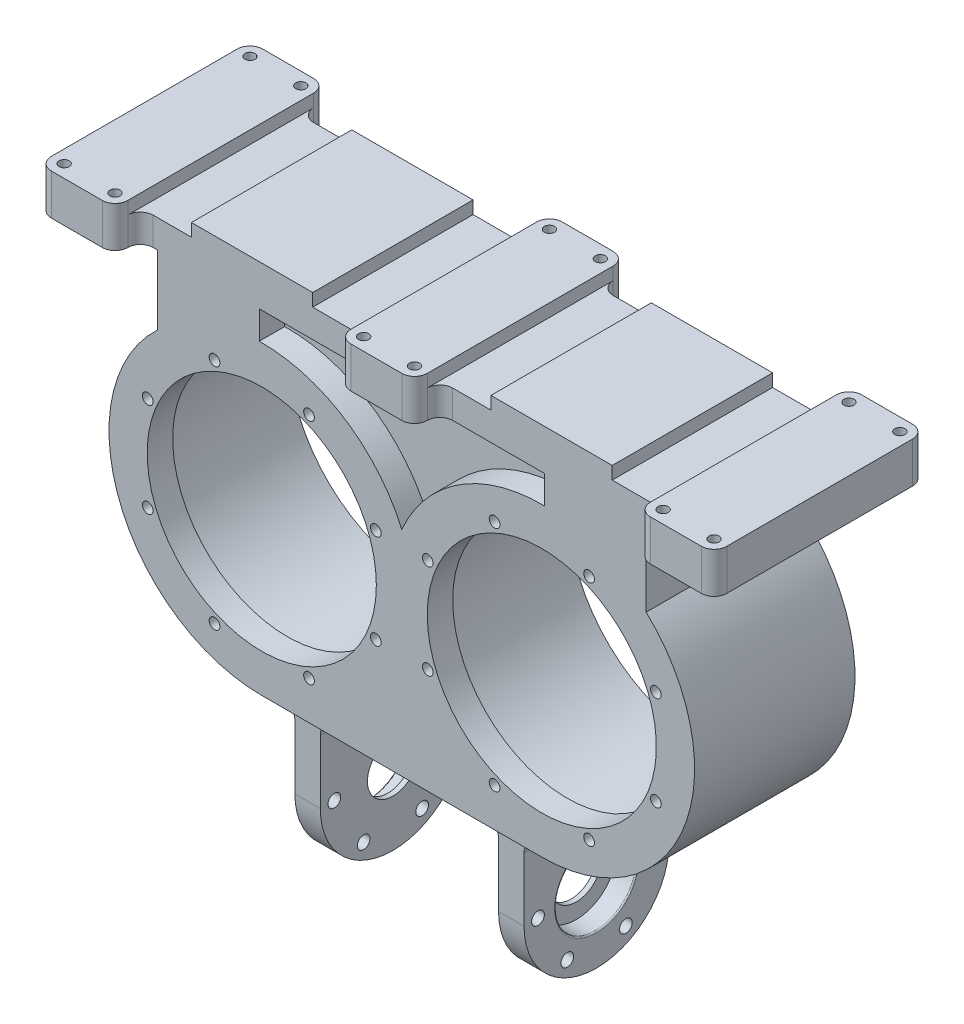
from build123d import *

# Parameters (mm, degrees)
SKETCH_1_R          = 52.5
EXTRUDE_1_DEPTH     = 63
SKETCH_3_R          = 10
EXTRUDE_3_DEPTH     = 10
EXTRUDE_5_DEPTH     = 57
EXTRUDE_START       = -10
SKETCH_6_R          = 52.5
SKETCH_6_R_2        = 45
EXTRUDE_6_DEPTH     = 10
SKETCH_9_R          = 2.1
CUT_EXTRUDE_1_DEPTH = 10
CUT_EXTRUDE_START   = -10
CUT_EXTRUDE_2_DEPTH = 10
SKETCH_11_R         = 16
CUT_EXTRUDE_3_DEPTH = 8
FILLET_1_R          = 0.5
EXTRUDE_7_DEPTH     = 11.027752017
SKETCH_14_R         = 2.5
CUT_EXTRUDE_5_DEPTH = 135
EXTRUDE_START_2     = 5
SKETCH_16_W         = 47.641975029
SKETCH_16_H         = 63
EXTRUDE_8_DEPTH     = 5
SKETCH_15_R         = 2
CUT_EXTRUDE_7_DEPTH = 14


with BuildPart() as part:
    # 草图1 → 凸台-拉伸1 (new body)
    with BuildSketch(Plane.XY):
        with BuildLine():
            Line((-40.985160522, 43.820276322), (-40.985160522, 71.041954073))
            Line((-40.985160522, 71.041954073), (-77.641975029, 71.041954073))
            Line((-77.641975029, 71.041954073), (-77.641975029, 82.069706091))
            Line((-77.641975029, 82.069706091), (-40.985160522, 82.069706091))
            Line((-40.985160522, 82.069706091), (150.985160522, 82.069706091))
            Line((150.985160522, 82.069706091), (187.641975029, 82.069706091))
            Line((187.641975029, 82.069706091), (187.641975029, 71.041954073))
            Line((187.641975029, 71.041954073), (150.985160522, 71.041954073))
            Line((150.985160522, 71.041954073), (150.985160522, 43.820276322))
            ThreePointArc((150.985160522, 43.820276322), (165.808675756, -22.031607076), (110, -60))
            Line((110, -60), (0, -60))
            ThreePointArc((0, -60), (-55.808675756, -22.031607076), (-40.985160522, 43.820276322))
        make_face()
        Circle(SKETCH_1_R, mode=Mode.SUBTRACT)
        with Locations(Location((110, 0, 0), (0, 0, 180))):
            Circle(SKETCH_1_R, mode=Mode.SUBTRACT)
    extrude(amount=EXTRUDE_1_DEPTH)

    # 草图3 → 凸台-拉伸3 (add)
    with BuildSketch(Plane(origin=(10, 0, 0), x_dir=(0, 0, -1), z_dir=(1, 0, 0))):
        with BuildLine():
            Line((-60, -60), (-60, -90))
            ThreePointArc((-60, -90), (-31.5, -118.5), (-3, -90))
            Line((-3, -90), (-3, -60))
            Line((-3, -60), (-60, -60))
        make_face()
        with Locations((-31.5, -90)):
            Circle(SKETCH_3_R, mode=Mode.SUBTRACT)
    extrude_3 = extrude(amount=EXTRUDE_3_DEPTH)

    # 草图5 → 凸台-拉伸5 (add)
    with BuildSketch(Plane(origin=(0, 0, 3), x_dir=(-1, 0, 0), z_dir=(0, 0, -1))):
        with BuildLine():
            Line((-20, -65), (-20, -60))
            Line((-20, -60), (-25, -60))
            ThreePointArc((-25, -60), (-21.464466094, -61.464466094), (-20, -65))
        make_face()
        with BuildLine():
            Line((-10, -65), (-10, -60))
            Line((-10, -60), (-5, -60))
            ThreePointArc((-5, -60), (-8.535533906, -61.464466094), (-10, -65))
        make_face()
    extrude_5 = extrude(amount=-EXTRUDE_5_DEPTH)

    # 镜向1: 凸台-拉伸3, 凸台-拉伸5 across plane
    add(extrude_3.mirror(Plane(origin=(55, 0, 0), x_dir=(0, 0, 1), z_dir=(1, 0, 0))))
    add(extrude_5.mirror(Plane(origin=(55, 0, 0), x_dir=(0, 0, 1), z_dir=(1, 0, 0))))

    # 草图6 → 凸台-拉伸6 (add)
    # profile 1 of 2: a face of its own
    with BuildSketch(Plane.XY.offset(63).offset(EXTRUDE_START)):
        Circle(SKETCH_6_R)
        Circle(SKETCH_6_R_2, mode=Mode.SUBTRACT)
    # profile 2 of 2: a face of its own
    with BuildSketch(Plane.XY.offset(63).offset(EXTRUDE_START)):
        with Locations(Location((110, 0, 0), (0, 0, 180))):
            Circle(SKETCH_6_R)
        with Locations(Location((110, 0, 0), (0, 0, 180))):
            Circle(SKETCH_6_R_2, mode=Mode.SUBTRACT)
    extrude(amount=EXTRUDE_6_DEPTH)

    # 草图9 → 切除-拉伸1 (cut)
    with BuildSketch(Plane.XY.offset(63)):
        with Locations((65.191842673, 18.56014647)):
            Circle(SKETCH_9_R)
        with Locations((91.43985353, 44.808157327)):
            Circle(SKETCH_9_R)
        with Locations((128.56014647, 44.808157327)):
            Circle(SKETCH_9_R)
        with Locations((154.808157327, 18.56014647)):
            Circle(SKETCH_9_R)
        with Locations((154.808157327, -18.56014647)):
            Circle(SKETCH_9_R)
        with Locations((128.56014647, -44.808157327)):
            Circle(SKETCH_9_R)
        with Locations((91.43985353, -44.808157327)):
            Circle(SKETCH_9_R)
        with Locations((65.191842673, -18.56014647)):
            Circle(SKETCH_9_R)
    cut_extrude_1 = extrude(amount=-CUT_EXTRUDE_1_DEPTH, mode=Mode.SUBTRACT)

    # 镜向2: 切除-拉伸1 across plane
    add(cut_extrude_1.mirror(Plane(origin=(55, 0, 0), x_dir=(0, 0, 1), z_dir=(1, 0, 0))), mode=Mode.SUBTRACT)

    # 草图10 → 切除-拉伸2 (cut)
    with BuildSketch(Plane.XY.offset(63).offset(CUT_EXTRUDE_START)):
        with BuildLine():
            Line((110.985160522, 59.991911611), (110.985160522, 71.041954073))
            Line((110.985160522, 71.041954073), (-0.985160522, 71.041954073))
            Line((-0.985160522, 71.041954073), (-0.985160522, 59.991911611))
            ThreePointArc((-0.985160522, 59.991911611), (32.459672419, 50.461566231), (55, 23.979157617))
            ThreePointArc((55, 23.979157617), (77.540327581, 50.461566231), (110.985160522, 59.991911611))
        make_face()
    cut_extrude_2 = extrude(amount=CUT_EXTRUDE_2_DEPTH, mode=Mode.SUBTRACT)

    # 草图11 → 切除-拉伸3 (cut)
    with BuildSketch(Plane.ZY.offset(-10)):
        with Locations((31.5, -90)):
            Circle(SKETCH_11_R)
    cut_extrude_3 = extrude(amount=-CUT_EXTRUDE_3_DEPTH, mode=Mode.SUBTRACT)

    # 镜向3: 切除-拉伸2 across plane
    add(cut_extrude_2.mirror(Plane.XY.offset(31.5)), mode=Mode.SUBTRACT)

    # 镜向4: 切除-拉伸3 across plane
    add(cut_extrude_3.mirror(Plane(origin=(55, 0, 0), x_dir=(0, 0, 1), z_dir=(1, 0, 0))), mode=Mode.SUBTRACT)

    # 圆角1
    fillet_1_edges = [part.edges().sort_by_distance(p)[0] for p in [
        (10, -90, 15.5),
        (100, -90, 15.5),
    ]]
    fillet(fillet_1_edges, radius=FILLET_1_R)

    # 草图13 → 凸台-拉伸7 (add)
    with BuildSketch(Plane(origin=(0, 82.069706091, 0), x_dir=(1, 0, 0), z_dir=(0, 1, 0))):
        with BuildLine():
            Line((152.641975029, -63), (187.641975029, -63))
            Line((187.641975029, -63), (187.641975029, -68))
            ThreePointArc((187.641975029, -68), (186.177508935, -71.535533906), (182.641975029, -73))
            Line((182.641975029, -73), (162.641975029, -73))
            ThreePointArc((162.641975029, -73), (159.106441123, -71.535533906), (157.641975029, -68))
            ThreePointArc((157.641975029, -68), (156.177508935, -64.464466094), (152.641975029, -63))
        make_face()
        with BuildLine():
            Line((-52.641975029, -73), (-72.641975029, -73))
            ThreePointArc((-72.641975029, -73), (-76.177508935, -71.535533906), (-77.641975029, -68))
            Line((-77.641975029, -68), (-77.641975029, -63))
            Line((-77.641975029, -63), (-42.641975029, -63))
            ThreePointArc((-42.641975029, -63), (-46.177508935, -64.464466094), (-47.641975029, -68))
            ThreePointArc((-47.641975029, -68), (-49.106441123, -71.535533906), (-52.641975029, -73))
        make_face()
        with BuildLine():
            Line((162.641975029, 10), (182.641975029, 10))
            ThreePointArc((182.641975029, 10), (186.177508935, 8.535533906), (187.641975029, 5))
            Line((187.641975029, 5), (187.641975029, 0))
            Line((187.641975029, 0), (152.641975029, 0))
            ThreePointArc((152.641975029, 0), (156.177508935, 1.464466094), (157.641975029, 5))
            ThreePointArc((157.641975029, 5), (159.106441123, 8.535533906), (162.641975029, 10))
        make_face()
        with BuildLine():
            Line((-42.641975029, 0), (-77.641975029, 0))
            Line((-77.641975029, 0), (-77.641975029, 5))
            ThreePointArc((-77.641975029, 5), (-76.177508935, 8.535533906), (-72.641975029, 10))
            Line((-72.641975029, 10), (-52.641975029, 10))
            ThreePointArc((-52.641975029, 10), (-49.106441123, 8.535533906), (-47.641975029, 5))
            ThreePointArc((-47.641975029, 5), (-46.177508935, 1.464466094), (-42.641975029, 0))
        make_face()
        with BuildLine():
            Line((45, -73), (65, -73))
            ThreePointArc((65, -73), (68.535533906, -71.535533906), (70, -68))
            ThreePointArc((70, -68), (71.464466094, -64.464466094), (75, -63))
            Line((75, -63), (35, -63))
            ThreePointArc((35, -63), (38.535533906, -64.464466094), (40, -68))
            ThreePointArc((40, -68), (41.464466094, -71.535533906), (45, -73))
        make_face()
        with BuildLine():
            Line((75, 0), (35, 0))
            ThreePointArc((35, 0), (38.535533906, 1.464466094), (40, 5))
            ThreePointArc((40, 5), (41.464466094, 8.535533906), (45, 10))
            Line((45, 10), (65, 10))
            ThreePointArc((65, 10), (68.535533906, 8.535533906), (70, 5))
            ThreePointArc((70, 5), (71.464466094, 1.464466094), (75, 0))
        make_face()
    extrude(amount=-EXTRUDE_7_DEPTH)

    # 草图14 → 切除-拉伸5 (cut)
    with BuildSketch(Plane.ZY.offset(-10)):
        with Locations((8.5, -90)):
            Circle(SKETCH_14_R)
        with Locations((20, -70.081415713)):
            Circle(SKETCH_14_R)
        with Locations((43, -70.081415713)):
            Circle(SKETCH_14_R)
        with Locations((54.5, -90)):
            Circle(SKETCH_14_R)
        with Locations((43, -109.918584287)):
            Circle(SKETCH_14_R)
        with Locations((20, -109.918584287)):
            Circle(SKETCH_14_R)
    extrude(amount=-CUT_EXTRUDE_5_DEPTH, mode=Mode.SUBTRACT)

    # 草图16 → 凸台-拉伸8 (add)
    with BuildSketch(Plane(origin=(0, 82.069706091, 0), x_dir=(1, 0, 0), z_dir=(0, 1, 0)).offset(EXTRUDE_START_2)):
        with BuildLine():
            Line((-72.641975029, -73), (-52.641975029, -73))
            ThreePointArc((-52.641975029, -73), (-49.106441123, -71.535533906), (-47.641975029, -68))
            Line((-47.641975029, -68), (-47.641975029, 5))
            ThreePointArc((-47.641975029, 5), (-49.106441123, 8.535533906), (-52.641975029, 10))
            Line((-52.641975029, 10), (-72.641975029, 10))
            ThreePointArc((-72.641975029, 10), (-76.177508935, 8.535533906), (-77.641975029, 5))
            Line((-77.641975029, 5), (-77.641975029, -68))
            ThreePointArc((-77.641975029, -68), (-76.177508935, -71.535533906), (-72.641975029, -73))
        make_face()
        with BuildLine():
            Line((40, -68), (40, 5))
            ThreePointArc((40, 5), (41.464466094, 8.535533906), (45, 10))
            Line((45, 10), (65, 10))
            ThreePointArc((65, 10), (68.535533906, 8.535533906), (70, 5))
            Line((70, 5), (70, -68))
            ThreePointArc((70, -68), (68.535533906, -71.535533906), (65, -73))
            Line((65, -73), (45, -73))
            ThreePointArc((45, -73), (41.464466094, -71.535533906), (40, -68))
        make_face()
        with BuildLine():
            Line((162.641975029, 10), (182.641975029, 10))
            ThreePointArc((182.641975029, 10), (186.177508935, 8.535533906), (187.641975029, 5))
            Line((187.641975029, 5), (187.641975029, -68))
            ThreePointArc((187.641975029, -68), (186.177508935, -71.535533906), (182.641975029, -73))
            Line((182.641975029, -73), (162.641975029, -73))
            ThreePointArc((162.641975029, -73), (159.106441123, -71.535533906), (157.641975029, -68))
            Line((157.641975029, -68), (157.641975029, 5))
            ThreePointArc((157.641975029, 5), (159.106441123, 8.535533906), (162.641975029, 10))
        make_face()
        with Locations((113.820987515, -31.5)):
            Rectangle(SKETCH_16_W, SKETCH_16_H)
        with Locations((-3.820987515, -31.5)):
            Rectangle(SKETCH_16_W, SKETCH_16_H)
    extrude(amount=-EXTRUDE_8_DEPTH)

    # 草图15 → 切除-拉伸7 (cut, symmetric)
    with BuildSketch(Plane(origin=(0, 82.069706091, 0), x_dir=(1, 0, 0), z_dir=(0, 1, 0))):
        with Locations(Location((-72.641975029, 5, 0), (0, 0, 270))):
            Circle(SKETCH_15_R)
        with Locations(Location((-52.641975029, 5, 0), (0, 0, 270))):
            Circle(SKETCH_15_R)
        with Locations(Location((45, 5, 0), (0, 0, 270))):
            Circle(SKETCH_15_R)
        with Locations(Location((65, 5, 0), (0, 0, 270))):
            Circle(SKETCH_15_R)
        with Locations(Location((162.641975029, 5, 0), (0, 0, 270))):
            Circle(SKETCH_15_R)
        with Locations(Location((182.641975029, 5, 0), (0, 0, 270))):
            Circle(SKETCH_15_R)
        with Locations(Location((-72.641975029, -68, 0), (0, 0, 270))):
            Circle(SKETCH_15_R)
        with Locations(Location((-52.641975029, -68, 0), (0, 0, 270))):
            Circle(SKETCH_15_R)
        with Locations(Location((45, -68, 0), (0, 0, 270))):
            Circle(SKETCH_15_R)
        with Locations(Location((65, -68, 0), (0, 0, 270))):
            Circle(SKETCH_15_R)
        with Locations(Location((162.641975029, -68, 0), (0, 0, 270))):
            Circle(SKETCH_15_R)
        with Locations(Location((182.641975029, -68, 0), (0, 0, 270))):
            Circle(SKETCH_15_R)
    extrude(amount=CUT_EXTRUDE_7_DEPTH, both=True, mode=Mode.SUBTRACT)


solid = part.part
